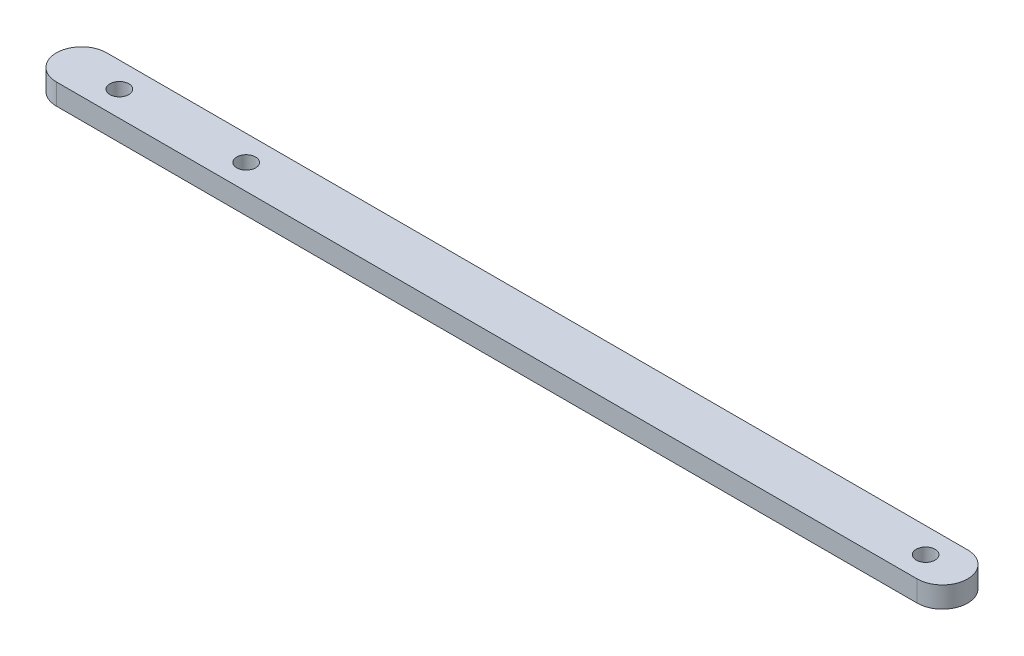
from build123d import *

# Parameters (mm, degrees)
BOSS_EXTRUDE1_DEPTH = 5
SKETCH2_R           = 2.25
CUT_EXTRUDE1_DEPTH  = 8


with BuildPart() as part:
    # Sketch1 → Boss-Extrude1 (new body)
    with BuildSketch(Plane(origin=(0, 0, 0), x_dir=(1, 0, 0), z_dir=(0, 1, 0))):
        with BuildLine():
            Line((-43.63843249, 6), (161.36156751, 6))
            ThreePointArc((161.36156751, 6), (167.36156751, 0), (161.36156751, -6))
            Line((161.36156751, -6), (-43.63843249, -6))
            ThreePointArc((-43.63843249, -6), (-49.63843249, 0), (-43.63843249, 6))
        make_face()
    extrude(amount=BOSS_EXTRUDE1_DEPTH)

    # Sketch2 → Cut-Extrude1 (cut)
    with BuildSketch(Plane(origin=(0, 5, 0), x_dir=(1, 0, 0), z_dir=(0, 1, 0))):
        with Locations(Location((-4.43843249, 0, 0), (0, 0, 270))):
            Circle(SKETCH2_R)
        with Locations(Location((157.36156751, 0, 0), (0, 0, 270))):
            Circle(SKETCH2_R)
        with Locations(Location((-34.63843249, 0, 0), (0, 0, 270))):
            Circle(SKETCH2_R)
    extrude(amount=-CUT_EXTRUDE1_DEPTH, mode=Mode.SUBTRACT)


solid = part.part
